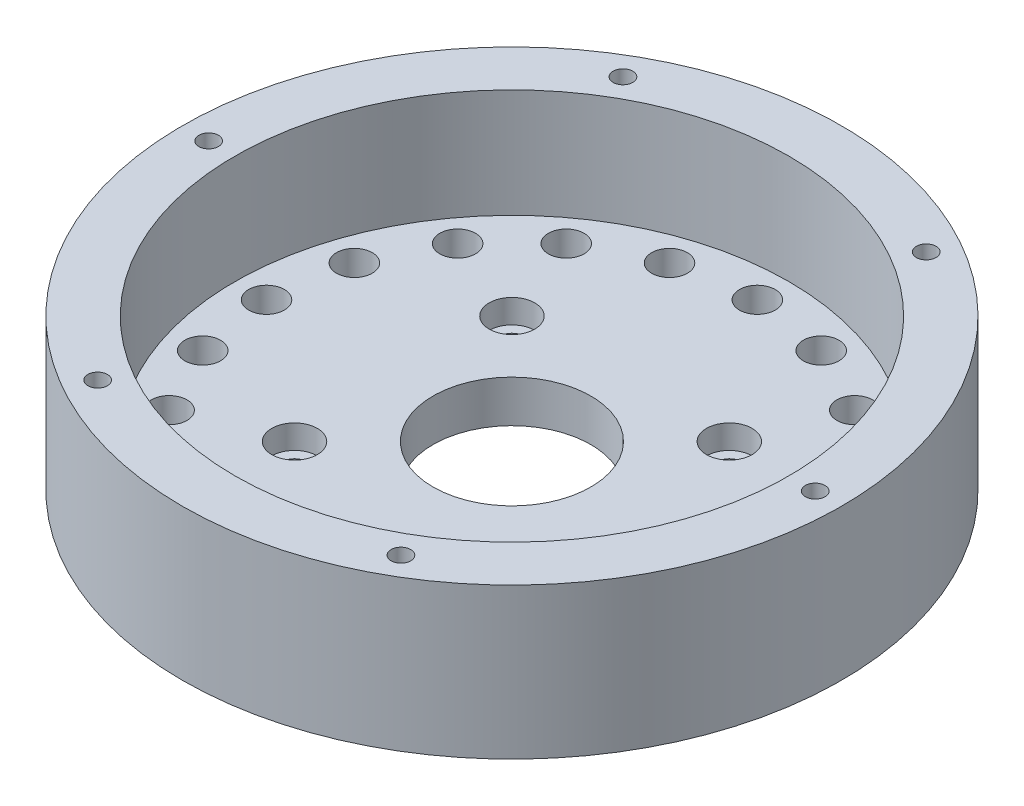
from build123d import *

# Parameters (mm, degrees)
SKETCH1_R                     = 47
BASE_BODY_DEPTH               = 21.5
SKETCH3_R                     = 39.5
CAVITY_DEPTH                  = 15.5
SKETCH4_R                     = 11.25
MOTOR_HOLE_DEPTH              = 69.251373613
MOTOR_SCREW_HOLES_D           = 3.6
MOTOR_SCREW_HOLES_CBORE_D     = 6.5
MOTOR_SCREW_HOLES_CBORE_DEPTH = 3.4
SKETCH8_R                     = 2.55
RING_PIN_HOLES_DEPTH          = 5
SKETCH9_R                     = 1.4
CAP_SCREW_HOLES_DEPTH         = 10


with BuildPart() as part:
    # Sketch1 → Base body (new body)
    with BuildSketch(Plane(origin=(0, 0, 0), x_dir=(1, 0, 0), z_dir=(0, 1, 0))):
        with Locations(Location((0, 0, 0), (0, 0, 270))):
            Circle(SKETCH1_R)
    extrude(amount=BASE_BODY_DEPTH)

    # Sketch3 → Cavity (cut)
    with BuildSketch(Plane(origin=(0, 21.5, 0), x_dir=(1, 0, 0), z_dir=(0, 1, 0))):
        with Locations(Location((0, 0, 0), (0, 0, 270))):
            Circle(SKETCH3_R)
    extrude(amount=-CAVITY_DEPTH, mode=Mode.SUBTRACT)

    # Sketch4 → Motor hole (cut, through all)
    with BuildSketch(Plane(origin=(0, 6, 0), x_dir=(1, 0, 0), z_dir=(0, 1, 0))):
        with Locations(Location((0, 0, 0), (0, 0, 270))):
            Circle(SKETCH4_R)
    extrude(amount=-MOTOR_HOLE_DEPTH, mode=Mode.SUBTRACT)

    # Motor screw holes (through all)
    with Locations(Plane(origin=(0, 6, 0), x_dir=(1, 0, 0), z_dir=(0, 1, 0))):
        with Locations((0, 0), (-15.5, -15.5), (15.5, 15.5), (15.5, -15.5), (-15.5, 15.5)):
            CounterBoreHole(MOTOR_SCREW_HOLES_D / 2, MOTOR_SCREW_HOLES_CBORE_D / 2, MOTOR_SCREW_HOLES_CBORE_DEPTH)

    # Sketch8 → Ring pin holes (cut)
    with BuildSketch(Plane(origin=(0, 6, 0), x_dir=(1, 0, 0), z_dir=(0, 1, 0))):
        with Locations(Location((-35, 0, 0), (0, 0, 270))):
            Circle(SKETCH8_R)
        with Locations(Location((-33.28697807, 10.815594803, 0), (0, 0, 270))):
            Circle(SKETCH8_R)
        with Locations(Location((-28.315594803, 20.57248383, 0), (0, 0, 270))):
            Circle(SKETCH8_R)
        with Locations(Location((-20.57248383, 28.315594803, 0), (0, 0, 270))):
            Circle(SKETCH8_R)
        with Locations(Location((-10.815594803, 33.28697807, 0), (0, 0, 270))):
            Circle(SKETCH8_R)
        with Locations(Location((0, 35, 0), (0, 0, 270))):
            Circle(SKETCH8_R)
        with Locations(Location((10.815594803, 33.28697807, 0), (0, 0, 270))):
            Circle(SKETCH8_R)
        with Locations(Location((20.57248383, 28.315594803, 0), (0, 0, 270))):
            Circle(SKETCH8_R)
        with Locations(Location((28.315594803, 20.57248383, 0), (0, 0, 270))):
            Circle(SKETCH8_R)
        with Locations(Location((33.28697807, 10.815594803, 0), (0, 0, 270))):
            Circle(SKETCH8_R)
        with Locations(Location((35, 0, 0), (0, 0, 270))):
            Circle(SKETCH8_R)
        with Locations(Location((33.28697807, -10.815594803, 0), (0, 0, 270))):
            Circle(SKETCH8_R)
        with Locations(Location((28.315594803, -20.57248383, 0), (0, 0, 270))):
            Circle(SKETCH8_R)
        with Locations(Location((20.57248383, -28.315594803, 0), (0, 0, 270))):
            Circle(SKETCH8_R)
        with Locations(Location((10.815594803, -33.28697807, 0), (0, 0, 270))):
            Circle(SKETCH8_R)
        with Locations(Location((0, -35, 0), (0, 0, 270))):
            Circle(SKETCH8_R)
        with Locations(Location((-10.815594803, -33.28697807, 0), (0, 0, 270))):
            Circle(SKETCH8_R)
        with Locations(Location((-20.57248383, -28.315594803, 0), (0, 0, 270))):
            Circle(SKETCH8_R)
        with Locations(Location((-28.315594803, -20.57248383, 0), (0, 0, 270))):
            Circle(SKETCH8_R)
        with Locations(Location((-33.28697807, -10.815594803, 0), (0, 0, 270))):
            Circle(SKETCH8_R)
    extrude(amount=-RING_PIN_HOLES_DEPTH, mode=Mode.SUBTRACT)

    # Sketch9 → Cap screw holes (cut)
    with BuildSketch(Plane(origin=(0, 21.5, 0), x_dir=(1, 0, 0), z_dir=(0, 1, 0))):
        with Locations(Location((-43.25, 0, 0), (0, 0, 270))):
            Circle(SKETCH9_R)
        with Locations(Location((-21.625, 37.455598714, 0), (0, 0, 270))):
            Circle(SKETCH9_R)
        with Locations(Location((21.625, 37.455598714, 0), (0, 0, 270))):
            Circle(SKETCH9_R)
        with Locations(Location((43.25, 0, 0), (0, 0, 270))):
            Circle(SKETCH9_R)
        with Locations(Location((21.625, -37.455598714, 0), (0, 0, 270))):
            Circle(SKETCH9_R)
        with Locations(Location((-21.625, -37.455598714, 0), (0, 0, 270))):
            Circle(SKETCH9_R)
    extrude(amount=-CAP_SCREW_HOLES_DEPTH, mode=Mode.SUBTRACT)


solid = part.part
